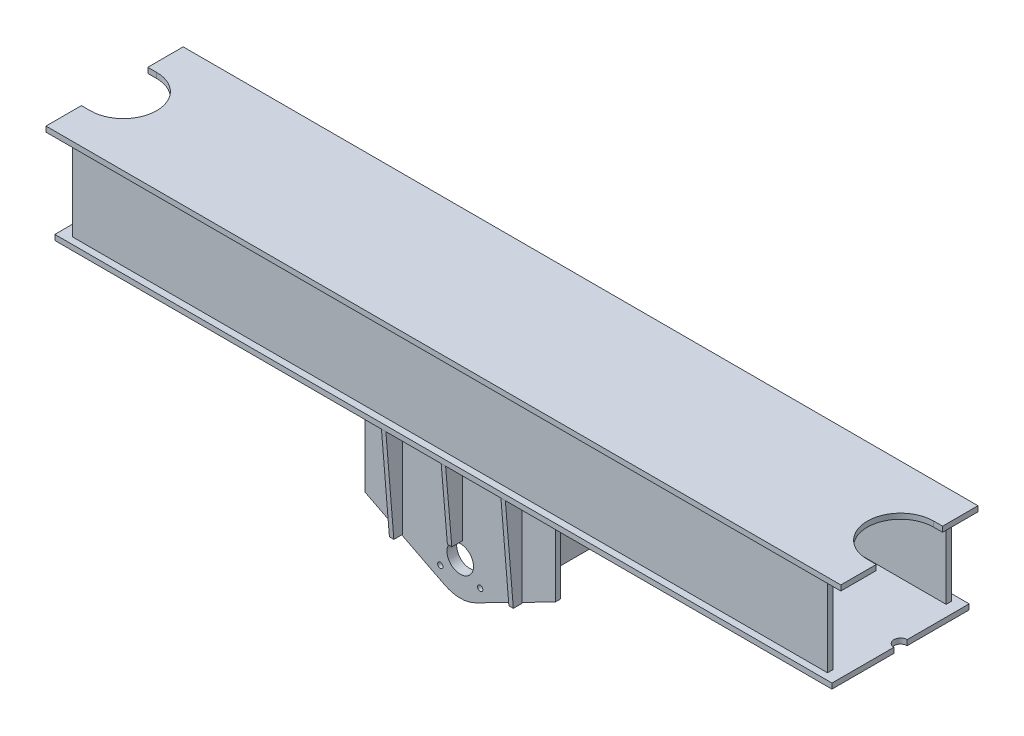
from build123d import *

# Parameters (mm, degrees)
EXTRUDE_1_DEPTH        = 12
SKETCH_2_W             = 1706
SKETCH_2_H             = 12
EXTRUDE_2_DEPTH        = 190
EXTRUDE_3_DEPTH        = 12
SKETCH_4_W             = 430
SKETCH_4_H             = 12
EXTRUDE_4_DEPTH        = 502
SKETCH_5_R             = 30
SKETCH_5_R_2           = 6
CUT_EXTRUDE_1_DEPTH    = 1065.139088653
SKETCH_6_W             = 10
SKETCH_6_H             = 165
EXTRUDE_5_DEPTH        = 38
CUT_EXTRUDE_2_DEPTH    = 10
SKETCH_8_W             = 10
SKETCH_8_H             = 210
EXTRUDE_6_DEPTH        = 190
SKETCH_9_W             = 10
SKETCH_9_H             = 38
EXTRUDE_7_DEPTH        = 220
CUT_EXTRUDE_3_DEPTH    = 18
PATTERN_LINEAR_1_COUNT = 2
PATTERN_LINEAR_1_PITCH = 270
SKETCH_11_W            = 12
SKETCH_11_H            = 234
SKETCH_11_H_2          = 210
EXTRUDE_8_DEPTH        = 190
SKETCH_12_R            = 75
SKETCH_12_R_2          = 30
SKETCH_12_R_3          = 6
EXTRUDE_9_DEPTH        = 10
PATTERN_LINEAR_2_COUNT = 2
PATTERN_LINEAR_2_PITCH = 200
SKETCH_14_W            = 10
SKETCH_14_H            = 210
EXTRUDE_10_DEPTH       = 100


with BuildPart() as part:
    # 草图1 → 凸台-拉伸1 (new body)
    with BuildSketch(Plane(origin=(0, 0, 0), x_dir=(1, 0, 0), z_dir=(0, 1, 0))):
        with BuildLine():
            Line((-898, 155), (898, 155))
            Line((898, 155), (898, 75))
            Line((898, 75), (878, 75))
            ThreePointArc((878, 75), (803, 0), (878, -75))
            Line((878, -75), (898, -75))
            Line((898, -75), (898, -155))
            Line((898, -155), (-898, -155))
            Line((-898, -155), (-898, -75))
            Line((-898, -75), (-878, -75))
            ThreePointArc((-878, -75), (-803, 0), (-878, 75))
            Line((-878, 75), (-898, 75))
            Line((-898, 75), (-898, 155))
        make_face()
    extrude(amount=EXTRUDE_1_DEPTH)

    # 草图2 → 凸台-拉伸2 (add)
    with BuildSketch(Plane(origin=(0, 0, 0), x_dir=(-1, 0, 0), z_dir=(0, -1, 0))):
        with Locations((0, 134)):
            Rectangle(SKETCH_2_W, SKETCH_2_H)
        with Locations((0, -134)):
            Rectangle(SKETCH_2_W, SKETCH_2_H)
    extrude(amount=EXTRUDE_2_DEPTH)

    # 草图3 → 凸台-拉伸3 (add)
    with BuildSketch(Plane.XZ.offset(190)):
        with BuildLine():
            Line((-878, 155), (878, 155))
            Line((878, 155), (878, 15))
            ThreePointArc((878, 15), (863, 0), (878, -15))
            Line((878, -15), (878, -155))
            Line((878, -155), (-878, -155))
            Line((-878, -155), (-878, -15))
            ThreePointArc((-878, -15), (-863, 0), (-878, 15))
            Line((-878, 15), (-878, 155))
        make_face()
    extrude(amount=EXTRUDE_3_DEPTH)

    # 草图4 → 凸台-拉伸4 (add)
    with BuildSketch(Plane(origin=(0, 0, 0), x_dir=(-1, 0, 0), z_dir=(0, -1, 0))):
        with Locations((0, -111)):
            Rectangle(SKETCH_4_W, SKETCH_4_H)
        with Locations((0, 111)):
            Rectangle(SKETCH_4_W, SKETCH_4_H)
    extrude(amount=EXTRUDE_4_DEPTH)

    # 草图5 → 切除-拉伸1 (cut, through all)
    with BuildSketch(Plane(origin=(0, 0, -117), x_dir=(-1, 0, 0), z_dir=(0, 0, -1))):
        with Locations((0, -405)):
            Circle(SKETCH_5_R)
        with Locations((-45, -440)):
            Circle(SKETCH_5_R_2)
        with Locations((45, -440)):
            Circle(SKETCH_5_R_2)
        with BuildLine():
            Line((-215, -382), (-215, -502))
            Line((-215, -502), (215, -502))
            Line((215, -502), (215, -382))
            Line((215, -382), (34.918275337, -473.627356408))
            ThreePointArc((34.918275337, -473.627356408), (0, -482), (-34.918275337, -473.627356408))
            Line((-34.918275337, -473.627356408), (-215, -382))
        make_face()
    extrude(amount=-CUT_EXTRUDE_1_DEPTH, mode=Mode.SUBTRACT)

    # 草图6 → 凸台-拉伸5 (add)
    with BuildSketch(Plane.XY.offset(117)):
        with Locations((0, -284.5)):
            Rectangle(SKETCH_6_W, SKETCH_6_H)
    extrude_5 = extrude(amount=EXTRUDE_5_DEPTH)

    # 镜向1: 凸台-拉伸5 across plane
    add(extrude_5.mirror(Plane.XY))

    # 草图7 → 切除-拉伸2 (cut)
    with BuildSketch(Plane.ZY.offset(5)):
        Polygon((-155, -202), (-155, -367), (-141, -367), align=None)
        Polygon((155, -202), (141, -367), (155, -367), align=None)
    extrude(amount=-CUT_EXTRUDE_2_DEPTH, mode=Mode.SUBTRACT)

    # 草图8 → 凸台-拉伸6 (add)
    with BuildSketch(Plane(origin=(0, -202, 0), x_dir=(-1, 0, 0), z_dir=(0, -1, 0))):
        with Locations((135, 0)):
            Rectangle(SKETCH_8_W, SKETCH_8_H)
        with Locations((-135, 0)):
            Rectangle(SKETCH_8_W, SKETCH_8_H)
    extrude(amount=EXTRUDE_6_DEPTH)

    # 草图9 → 凸台-拉伸7 (add)
    with BuildSketch(Plane(origin=(0, -202, 0), x_dir=(-1, 0, 0), z_dir=(0, -1, 0))):
        with Locations((135, -136)):
            Rectangle(SKETCH_9_W, SKETCH_9_H)
        with Locations((-135, -136)):
            Rectangle(SKETCH_9_W, SKETCH_9_H)
        with Locations((135, 136)):
            Rectangle(SKETCH_9_W, SKETCH_9_H)
        with Locations((-135, 136)):
            Rectangle(SKETCH_9_W, SKETCH_9_H)
    extrude(amount=EXTRUDE_7_DEPTH)

    # 草图10 → 切除-拉伸3 (cut)
    with BuildSketch(Plane(origin=(140, 0, 0), x_dir=(0, 0, -1), z_dir=(1, 0, 0))):
        Polygon((-155, -202), (-155, -422), (-137, -422), align=None)
        Polygon((155, -202), (155, -422), (137, -422), align=None)
    cut_extrude_3 = extrude(amount=-CUT_EXTRUDE_3_DEPTH, mode=Mode.SUBTRACT)

    # 阵列(线性)1: 切除-拉伸3 ×2
    with Locations(*[(-i * PATTERN_LINEAR_1_PITCH, 0, 0) for i in range(1, PATTERN_LINEAR_1_COUNT)]):
        add(cut_extrude_3, mode=Mode.SUBTRACT)

    # 草图11 → 凸台-拉伸8 (add)
    with BuildSketch(Plane(origin=(0, 0, 0), x_dir=(-1, 0, 0), z_dir=(0, -1, 0))):
        with Locations((-221, 0)):
            Rectangle(SKETCH_11_W, SKETCH_11_H)
        with Locations((221, 0)):
            Rectangle(SKETCH_11_W, SKETCH_11_H)
        with Locations((136, 0)):
            Rectangle(SKETCH_11_W, SKETCH_11_H_2)
        with Locations((-136, 0)):
            Rectangle(SKETCH_11_W, SKETCH_11_H_2)
    extrude(amount=EXTRUDE_8_DEPTH)

    # 草图12 → 凸台-拉伸9 (add)
    with BuildSketch(Plane.XY.offset(-105)):
        with Locations(Location((0, -405, 0), (0, 0, 180))):
            Circle(SKETCH_12_R)
        with Locations(Location((0, -405, 0), (0, 0, 180))):
            Circle(SKETCH_12_R_2, mode=Mode.SUBTRACT)
        with Locations(Location((-45, -440, 0), (0, 0, 180))):
            Circle(SKETCH_12_R_3, mode=Mode.SUBTRACT)
        with Locations(Location((45, -440, 0), (0, 0, 180))):
            Circle(SKETCH_12_R_3, mode=Mode.SUBTRACT)
    extrude_9 = extrude(amount=EXTRUDE_9_DEPTH)

    # 阵列(线性)2: 凸台-拉伸9 ×2
    with Locations(*[(0, 0, i * PATTERN_LINEAR_2_PITCH) for i in range(1, PATTERN_LINEAR_2_COUNT)]):
        add(extrude_9)

    # 草图14 → 凸台-拉伸10 (add)
    with BuildSketch(Plane(origin=(0, -202, 0), x_dir=(-1, 0, 0), z_dir=(0, -1, 0))):
        with Locations((65, 0)):
            Rectangle(SKETCH_14_W, SKETCH_14_H)
        with Locations((-65, 0)):
            Rectangle(SKETCH_14_W, SKETCH_14_H)
    extrude(amount=EXTRUDE_10_DEPTH)


solid = part.part
